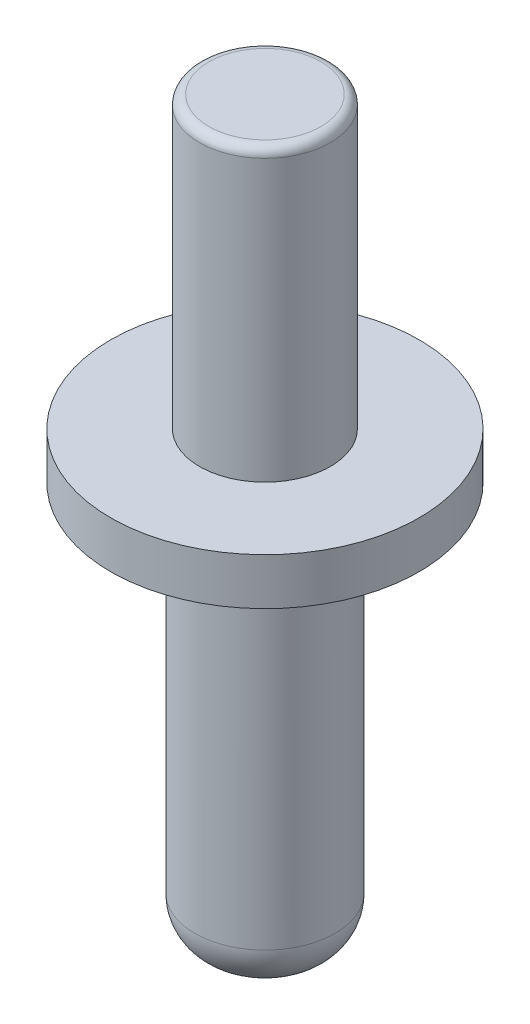
from build123d import *

# Parameters (mm, degrees)
FILLET_1_R = 0.1
FILLET_2_R = 0.5


with BuildPart() as part:
    # 草图1 → 旋转1 (revolve)
    with BuildSketch(Plane.XY):
        Polygon((0, -4.3), (-0.75, -4.3), (-0.75, 0), (-1.65, 0), (-1.65, 0.5), (-0.7, 0.5), (-0.7, 3.6), (0, 3.6), align=None)
    revolve(axis=Axis((0, 16.287242456, 0), (0, -1, 0)))

    # 圆角1
    fillet_1_edges = [part.edges().sort_by_distance(p)[0] for p in [
        (0.7, 3.6, 0),
    ]]
    fillet(fillet_1_edges, radius=FILLET_1_R)

    # 圆角2
    fillet_2_edges = [part.edges().sort_by_distance(p)[0] for p in [
        (0.75, -4.3, 0),
    ]]
    fillet(fillet_2_edges, radius=FILLET_2_R)


solid = part.part
